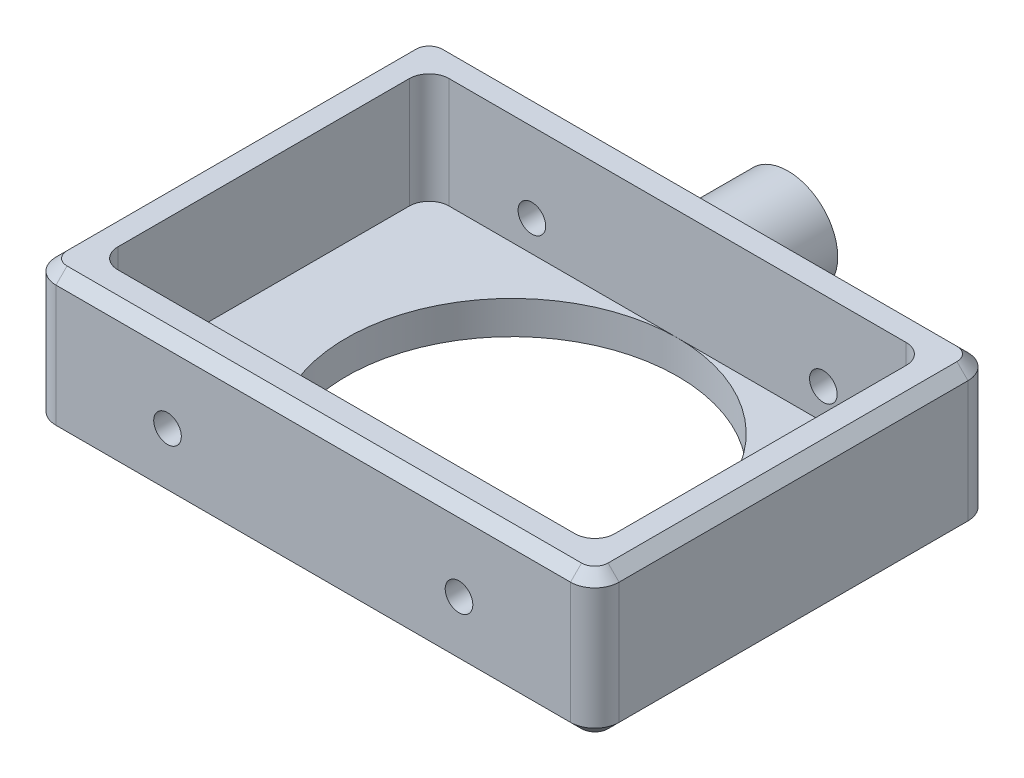
from build123d import *

# Parameters (mm, degrees)
SKETCH1_W           = 51
SKETCH1_H           = 36
BOSS_EXTRUDE1_DEPTH = 3
SKETCH2_W           = 45
SKETCH2_H           = 30
BOSS_EXTRUDE2_DEPTH = 10
FILLET1_R           = 1.8
FILLET2_R           = 2.2
CHAMFER1_SIZE       = 1
SKETCH3_R           = 15
CUT_EXTRUDE1_DEPTH  = 10
SKETCH4_R           = 1.25
CUT_EXTRUDE2_DEPTH  = 50
CHAMFER2_SIZE       = 1
SKETCH5_R           = 4.5
BOSS_EXTRUDE3_DEPTH = 7


with BuildPart() as part:
    # Sketch1 → Boss-Extrude1 (new body)
    with BuildSketch(Plane(origin=(0, 0, 0), x_dir=(1, 0, 0), z_dir=(0, 1, 0))):
        Rectangle(SKETCH1_W, SKETCH1_H)
    extrude(amount=BOSS_EXTRUDE1_DEPTH)

    # Sketch2 → Boss-Extrude2 (add)
    with BuildSketch(Plane(origin=(0, 3, 0), x_dir=(1, 0, 0), z_dir=(0, 1, 0))):
        Polygon((-22.5, 18), (-25.5, 18), (-25.5, 15), (-25.5, -15), (-25.5, -18), (-22.5, -18), (22.5, -18), (25.5, -18), (25.5, -15), (25.5, 15), (25.5, 18), (22.5, 18), align=None)
        Rectangle(SKETCH2_W, SKETCH2_H, mode=Mode.SUBTRACT)
    extrude(amount=BOSS_EXTRUDE2_DEPTH)

    # Fillet1
    fillet1_edges = [part.edges().sort_by_distance(p)[0] for p in [
        (22.5, 8, 15),
        (-22.5, 8, 15),
        (-22.5, 8, -15),
        (22.5, 8, -15),
    ]]
    fillet(fillet1_edges, radius=FILLET1_R)

    # Fillet2
    fillet2_edges = [part.edges().sort_by_distance(p)[0] for p in [
        (25.5, 6.5, 18),
        (-25.5, 6.5, 18),
        (-25.5, 6.5, -18),
        (25.5, 6.5, -18),
    ]]
    fillet(fillet2_edges, radius=FILLET2_R)

    # Chamfer1
    chamfer1_edges = [part.edges().sort_by_distance(p)[0] for p in [
        (-25.5, 0, 0),
        (25.5, 0, 0),
        (0, 0, 18),
        (0, 0, -18),
        (24.855634919, 0, 17.355634919),
        (24.855634919, 0, -17.355634919),
        (-24.855634919, 0, 17.355634919),
        (-24.855634919, 0, -17.355634919),
    ]]
    chamfer(chamfer1_edges, length=CHAMFER1_SIZE)

    # Sketch3 → Cut-Extrude1 (cut)
    with BuildSketch(Plane(origin=(0, 3, 0), x_dir=(1, 0, 0), z_dir=(0, 1, 0))):
        with Locations(Location((0, 0, 0), (0, 0, 90))):
            Circle(SKETCH3_R)
    extrude(amount=-CUT_EXTRUDE1_DEPTH, mode=Mode.SUBTRACT)

    # Sketch4 → Cut-Extrude2 (cut)
    with BuildSketch(Plane.XY.offset(18)):
        with Locations((-13.2, 5.8)):
            Circle(SKETCH4_R)
        with Locations((13.2, 5.8)):
            Circle(SKETCH4_R)
    extrude(amount=-CUT_EXTRUDE2_DEPTH, mode=Mode.SUBTRACT)

    # Chamfer2
    chamfer2_edges = [part.edges().sort_by_distance(p)[0] for p in [
        (-25.5, 13, 0),
        (0, 13, -18),
        (0, 13, 18),
        (25.5, 13, 0),
        (24.855634919, 13, 17.355634919),
        (24.855634919, 13, -17.355634919),
        (-24.855634919, 13, 17.355634919),
        (-24.855634919, 13, -17.355634919),
    ]]
    chamfer(chamfer2_edges, length=CHAMFER2_SIZE)

    # Sketch5 → Boss-Extrude3 (add)
    with BuildSketch(Plane(origin=(0, 0, -18), x_dir=(-1, 0, 0), z_dir=(0, 0, -1))):
        with Locations(Location((0, 6.6, 0), (0, 0, 180))):
            Circle(SKETCH5_R)
    extrude(amount=BOSS_EXTRUDE3_DEPTH)


solid = part.part
